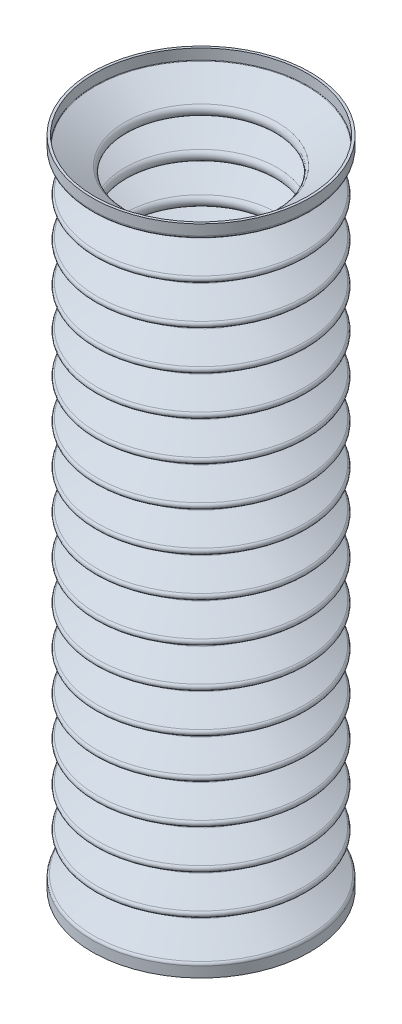
from build123d import *

# Parameters (mm, degrees)
SHELL1_T = -1.1938


with BuildPart() as part:
    # Sketch1 → Revolve2 (revolve)
    with BuildSketch(Plane.XY):
        with BuildLine():
            Line((0, 0), (0, 317.5))
            Line((0, 317.5), (52.959, 317.5))
            Line((52.959, 317.5), (52.959, 312.445471531))
            ThreePointArc((52.959, 312.445471531), (52.741792158, 311.6613349), (52.152083654, 311.10071615))
            Line((52.152083654, 311.10071615), (37.573835527, 303.326942881))
            ThreePointArc((37.573835527, 303.326942881), (36.76691918, 301.9821875), (37.573835527, 300.637432119))
            Line((37.573835527, 300.637432119), (50.437164473, 293.778130381))
            ThreePointArc((50.437164473, 293.778130381), (51.24408082, 292.433375), (50.437164473, 291.088619619))
            Line((50.437164473, 291.088619619), (37.573835527, 284.229317881))
            ThreePointArc((37.573835527, 284.229317881), (36.76691918, 282.8845625), (37.573835527, 281.539807119))
            Line((37.573835527, 281.539807119), (50.437164473, 274.680505381))
            ThreePointArc((50.437164473, 274.680505381), (51.24408082, 273.33575), (50.437164473, 271.990994619))
            Line((50.437164473, 271.990994619), (37.573835527, 265.131692881))
            ThreePointArc((37.573835527, 265.131692881), (36.76691918, 263.7869375), (37.573835527, 262.442182119))
            Line((37.573835527, 262.442182119), (50.437164473, 255.582880381))
            ThreePointArc((50.437164473, 255.582880381), (51.24408082, 254.238125), (50.437164473, 252.893369619))
            Line((50.437164473, 252.893369619), (37.573835527, 246.034067881))
            ThreePointArc((37.573835527, 246.034067881), (36.76691918, 244.6893125), (37.573835527, 243.344557119))
            Line((37.573835527, 243.344557119), (50.437164473, 236.485255381))
            ThreePointArc((50.437164473, 236.485255381), (51.24408082, 235.1405), (50.437164473, 233.795744619))
            Line((50.437164473, 233.795744619), (37.573835527, 226.936442881))
            ThreePointArc((37.573835527, 226.936442881), (36.76691918, 225.5916875), (37.573835527, 224.246932119))
            Line((37.573835527, 224.246932119), (50.437164473, 217.387630381))
            ThreePointArc((50.437164473, 217.387630381), (51.24408082, 216.042875), (50.437164473, 214.698119619))
            Line((50.437164473, 214.698119619), (37.573835527, 207.838817881))
            ThreePointArc((37.573835527, 207.838817881), (36.76691918, 206.4940625), (37.573835527, 205.149307119))
            Line((37.573835527, 205.149307119), (50.437164473, 198.290005381))
            ThreePointArc((50.437164473, 198.290005381), (51.24408082, 196.94525), (50.437164473, 195.600494619))
            Line((50.437164473, 195.600494619), (37.573835527, 188.741192881))
            ThreePointArc((37.573835527, 188.741192881), (36.76691918, 187.3964375), (37.573835527, 186.051682119))
            Line((37.573835527, 186.051682119), (50.437164473, 179.192380381))
            ThreePointArc((50.437164473, 179.192380381), (51.24408082, 177.847625), (50.437164473, 176.502869619))
            Line((50.437164473, 176.502869619), (37.573835527, 169.643567881))
            ThreePointArc((37.573835527, 169.643567881), (36.76691918, 168.2988125), (37.573835527, 166.954057119))
            Line((37.573835527, 166.954057119), (50.437164473, 160.094755381))
            ThreePointArc((50.437164473, 160.094755381), (51.24408082, 158.75), (50.437164473, 157.405244619))
            Line((50.437164473, 157.405244619), (37.573835527, 150.545942881))
            ThreePointArc((37.573835527, 150.545942881), (36.76691918, 149.2011875), (37.573835527, 147.856432119))
            Line((37.573835527, 147.856432119), (50.437164473, 140.997130381))
            ThreePointArc((50.437164473, 140.997130381), (51.24408082, 139.652375), (50.437164473, 138.307619619))
            Line((50.437164473, 138.307619619), (37.573835527, 131.448317881))
            ThreePointArc((37.573835527, 131.448317881), (36.76691918, 130.1035625), (37.573835527, 128.758807119))
            Line((37.573835527, 128.758807119), (50.437164473, 121.899505381))
            ThreePointArc((50.437164473, 121.899505381), (51.24408082, 120.55475), (50.437164473, 119.209994619))
            Line((50.437164473, 119.209994619), (37.573835527, 112.350692881))
            ThreePointArc((37.573835527, 112.350692881), (36.76691918, 111.0059375), (37.573835527, 109.661182119))
            Line((37.573835527, 109.661182119), (50.437164473, 102.801880381))
            ThreePointArc((50.437164473, 102.801880381), (51.24408082, 101.457125), (50.437164473, 100.112369619))
            Line((50.437164473, 100.112369619), (37.573835527, 93.253067881))
            ThreePointArc((37.573835527, 93.253067881), (36.76691918, 91.9083125), (37.573835527, 90.563557119))
            Line((37.573835527, 90.563557119), (50.437164473, 83.704255381))
            ThreePointArc((50.437164473, 83.704255381), (51.24408082, 82.3595), (50.437164473, 81.014744619))
            Line((50.437164473, 81.014744619), (37.573835527, 74.155442881))
            ThreePointArc((37.573835527, 74.155442881), (36.76691918, 72.8106875), (37.573835527, 71.465932119))
            Line((37.573835527, 71.465932119), (50.437164473, 64.606630381))
            ThreePointArc((50.437164473, 64.606630381), (51.24408082, 63.261875), (50.437164473, 61.917119619))
            Line((50.437164473, 61.917119619), (37.573835527, 55.057817881))
            ThreePointArc((37.573835527, 55.057817881), (36.76691918, 53.7130625), (37.573835527, 52.368307119))
            Line((37.573835527, 52.368307119), (50.437164473, 45.509005381))
            ThreePointArc((50.437164473, 45.509005381), (51.24408082, 44.16425), (50.437164473, 42.819494619))
            Line((50.437164473, 42.819494619), (37.573835527, 35.960192881))
            ThreePointArc((37.573835527, 35.960192881), (36.76691918, 34.6154375), (37.573835527, 33.270682119))
            Line((37.573835527, 33.270682119), (50.437164473, 26.411380381))
            ThreePointArc((50.437164473, 26.411380381), (51.24408082, 25.066625), (50.437164473, 23.721869619))
            Line((50.437164473, 23.721869619), (37.573835527, 16.862567881))
            ThreePointArc((37.573835527, 16.862567881), (36.76691918, 15.5178125), (37.573835527, 14.173057119))
            Line((37.573835527, 14.173057119), (52.152083654, 6.39928385))
            ThreePointArc((52.152083654, 6.39928385), (52.741792158, 5.8386651), (52.959, 5.054528469))
            Line((52.959, 5.054528469), (52.959, 0))
            Line((52.959, 0), (0, 0))
        make_face()
    revolve(axis=Axis((0, 0, 0), (0, 1, 0)))

    # Shell1
    shell1_openings = [part.faces().sort_by_distance(p)[0] for p in [
        (0, 0, 0),
        (0, 317.5, 0),
    ]]
    offset(amount=SHELL1_T, openings=shell1_openings, kind=Kind.INTERSECTION)


solid = part.part
